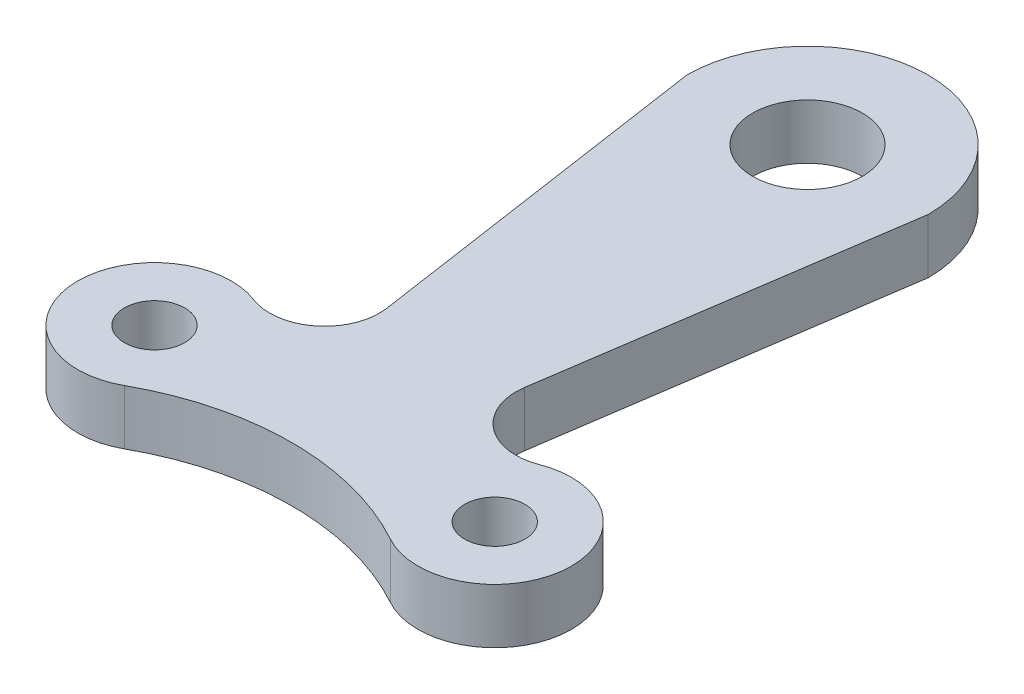
from build123d import *

# Parameters (mm, degrees)
SKETCH1_R           = 10
SKETCH1_R_2         = 5.5
BOSS_EXTRUDE1_DEPTH = 10


with BuildPart() as part:
    # Sketch1 → Boss-Extrude1 (new body)
    with BuildSketch(Plane(origin=(0, 0, 0), x_dir=(1, 0, 0), z_dir=(0, 1, 0))):
        with BuildLine():
            Line((-22, 0), (-12.527017524, -64.124804454))
            ThreePointArc((-12.527017524, -64.124804454), (-16.163432373, -73.387478219), (-25.994798684, -74.925293128))
            ThreePointArc((-25.994798684, -74.925293128), (-44.965677172, -88.979725021), (-24.218363132, -100.247832518))
            ThreePointArc((-24.218363132, -100.247832518), (0.000559759, -93.990091526), (24.21978519, -100.246661496))
            ThreePointArc((24.21978519, -100.246661496), (44.96401141, -88.978987225), (25.994886362, -74.927094121))
            ThreePointArc((25.994886362, -74.927094121), (16.163301714, -73.389548338), (12.526730263, -64.126748988))
            Line((12.526730263, -64.126748988), (22, 0))
            ThreePointArc((22, 0), (0, 22), (-22, 0))
        make_face()
        with Locations(Location((0, 0, 0), (0, 0, 270))):
            Circle(SKETCH1_R, mode=Mode.SUBTRACT)
        with Locations(Location((31, -88, 0), (0, 0, 270))):
            Circle(SKETCH1_R_2, mode=Mode.SUBTRACT)
        with Locations(Location((-31, -88, 0), (0, 0, 90))):
            Circle(SKETCH1_R_2, mode=Mode.SUBTRACT)
    extrude(amount=BOSS_EXTRUDE1_DEPTH)


solid = part.part
